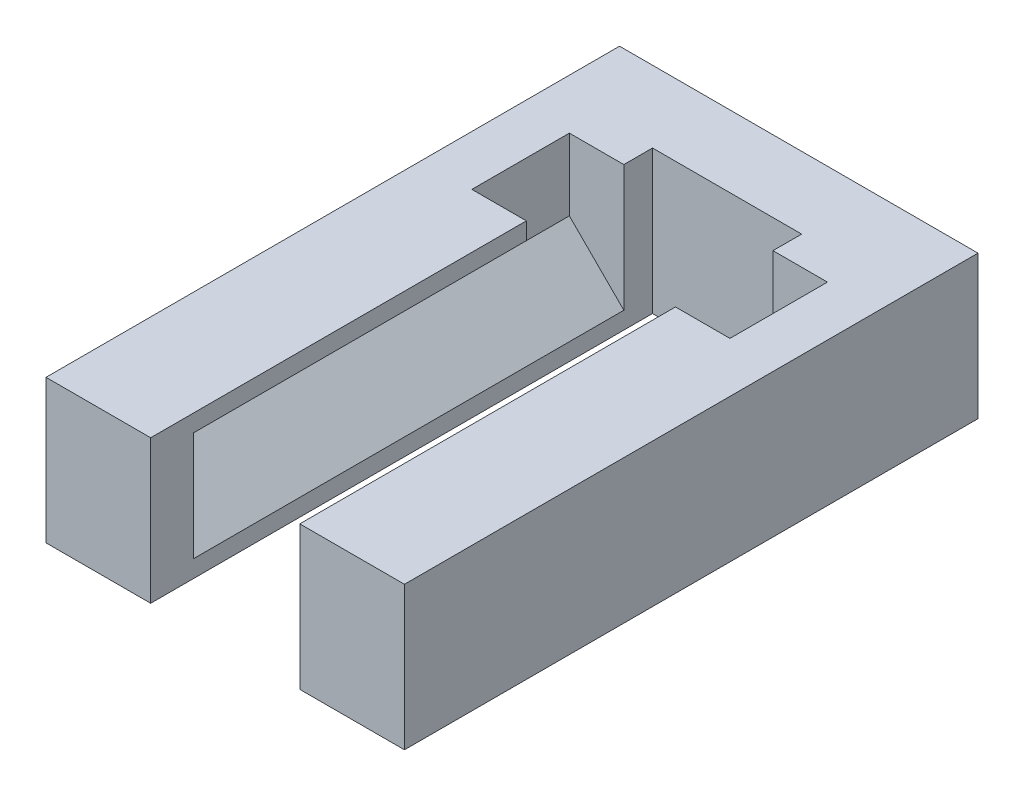
from build123d import *

# Parameters (mm, degrees)
SKETCH2_W           = 25
SKETCH2_H           = 10
BOSS_EXTRUDE1_DEPTH = 40
SKETCH3_W           = 10.4
SKETCH3_H           = 35
CUT_EXTRUDE1_DEPTH  = 44.084219849
SKETCH4_W           = 18
SKETCH4_H           = 6.8
CUT_EXTRUDE2_DEPTH  = 5
CUT_EXTRUDE3_DEPTH  = 30


with BuildPart() as part:
    # Sketch2 → Boss-Extrude1 (new body)
    with BuildSketch(Plane.XY):
        Rectangle(SKETCH2_W, SKETCH2_H)
    extrude(amount=BOSS_EXTRUDE1_DEPTH)

    # Sketch3 → Cut-Extrude1 (cut, through all)
    with BuildSketch(Plane(origin=(0, 5, 0), x_dir=(1, 0, 0), z_dir=(0, 1, 0))):
        with Locations((0, -22.5)):
            Rectangle(SKETCH3_W, SKETCH3_H)
    extrude(amount=-CUT_EXTRUDE1_DEPTH, mode=Mode.SUBTRACT)

    # Sketch4 → Cut-Extrude2 (cut)
    with BuildSketch(Plane(origin=(0, 5, 0), x_dir=(1, 0, 0), z_dir=(0, 1, 0))):
        with Locations((0, -10.4)):
            Rectangle(SKETCH4_W, SKETCH4_H)
    extrude(amount=-CUT_EXTRUDE2_DEPTH, mode=Mode.SUBTRACT)

    # Sketch5 → Cut-Extrude3 (cut)
    with BuildSketch(Plane.XY.offset(7)):
        Polygon((5.2, 3.8), (9, 0), (5.2, -3.8), align=None)
        Polygon((-5.2, -3.8), (-5.2, 3.8), (-9, 0), align=None)
    extrude(amount=CUT_EXTRUDE3_DEPTH, mode=Mode.SUBTRACT)


solid = part.part
